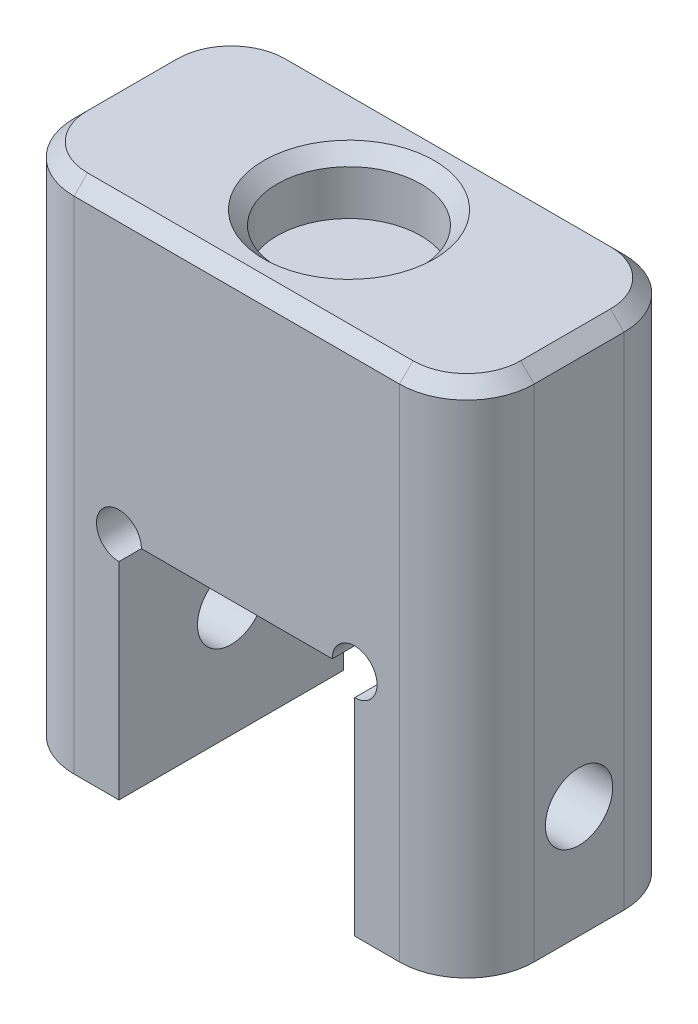
from build123d import *

# Parameters (mm, degrees)
EXTRUDE_1_DEPTH     = 10
SKETCH_2_R          = 3.2
CUT_EXTRUDE_1_DEPTH = 2.6
SKETCH_3_R          = 1.5
CUT_EXTRUDE_2_DEPTH = 26.521608492
SKETCH_4_R          = 1
CUT_EXTRUDE_3_DEPTH = 19.334802971
FILLET_1_R          = 3
CHAMFER_1_SIZE      = 0.6


with BuildPart() as part:
    # ｽｹｯﾁ1 → ﾎﾞｽ - 押し出し1 (new body)
    with BuildSketch(Plane.XY):
        Polygon((-10.25, 11.45), (-10.25, -11.45), (-5.25, -11.45), (-5.25, -1.25), (5.25, -1.25), (5.25, -11.45), (10.25, -11.45), (10.25, 11.45), align=None)
    extrude(amount=EXTRUDE_1_DEPTH)

    # ｽｹｯﾁ2 → ｶｯﾄ - 押し出し1 (cut)
    with BuildSketch(Plane(origin=(0, 11.45, 0), x_dir=(1, 0, 0), z_dir=(0, 1, 0))):
        with Locations(Location((0, -5, 0), (0, 0, 180))):
            Circle(SKETCH_2_R)
    extrude(amount=-CUT_EXTRUDE_1_DEPTH, mode=Mode.SUBTRACT)

    # ｽｹｯﾁ3 → ｶｯﾄ - 押し出し2 (cut, through all)
    with BuildSketch(Plane(origin=(10.25, 0, 0), x_dir=(0, 0, -1), z_dir=(1, 0, 0))):
        with Locations(Location((-5, -6.45, 0), (0, 0, 90))):
            Circle(SKETCH_3_R)
    extrude(amount=-CUT_EXTRUDE_2_DEPTH, mode=Mode.SUBTRACT)

    # ｽｹｯﾁ4 → ｶｯﾄ - 押し出し3 (cut, through all)
    with BuildSketch(Plane.XY.offset(10)):
        with Locations((5.25, -1.25)):
            Circle(SKETCH_4_R)
        with Locations((-5.25, -1.25)):
            Circle(SKETCH_4_R)
    extrude(amount=-CUT_EXTRUDE_3_DEPTH, mode=Mode.SUBTRACT)

    # ﾌｨﾚｯﾄ1
    fillet_1_edges = [part.edges().sort_by_distance(p)[0] for p in [
        (-10.25, 0, 0),
        (10.25, 0, 0),
        (10.25, 0, 10),
        (-10.25, 0, 10),
    ]]
    fillet(fillet_1_edges, radius=FILLET_1_R)

    # 面取り1
    chamfer_1_edges = [part.edges().sort_by_distance(p)[0] for p in [
        (3.2, 11.45, 5),
        (0, 11.45, 0),
        (-10.25, 11.45, 5),
        (0, 11.45, 10),
        (10.25, 11.45, 5),
        (9.371320344, 11.45, 9.121320344),
        (9.371320344, 11.45, 0.878679656),
        (-9.371320344, 11.45, 9.121320344),
        (-9.371320344, 11.45, 0.878679656),
    ]]
    chamfer(chamfer_1_edges, length=CHAMFER_1_SIZE)


solid = part.part
